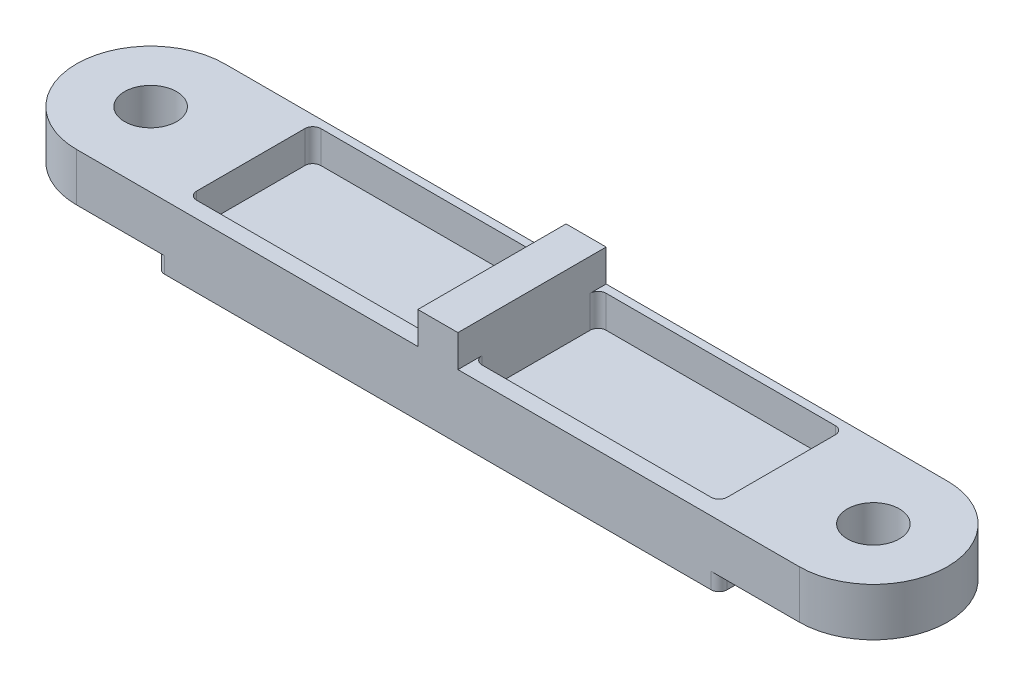
from build123d import *

# Parameters (mm, degrees)
SKETCH1_W           = 35.1
SKETCH1_H           = 18.5
BOSS_EXTRUDE1_DEPTH = 8
SKETCH10_R          = 3.25
BOLT_EXTRUDE_DEPTH  = 6
SKETCH7_W           = 33.1
SKETCH7_H           = 15.5
CUT_EXTRUDE5_DEPTH  = 4
SKETCH8_W           = 5
SKETCH8_H           = 18.5
BOSS_EXTRUDE3_DEPTH = 8
FILLET6_R           = 1


with BuildPart() as part:
    # Sketch1 → Boss-Extrude1 (new body)
    with BuildSketch(Plane(origin=(0, 0, 0), x_dir=(1, 0, 0), z_dir=(0, 1, 0))):
        with Locations((-17.55, 0)):
            Rectangle(SKETCH1_W, SKETCH1_H)
    extrude(amount=BOSS_EXTRUDE1_DEPTH)

    # Sketch10 → bolt extrude (add)
    with BuildSketch(Plane(origin=(0, 8, 0), x_dir=(1, 0, 0), z_dir=(0, 1, 0))):
        with BuildLine():
            Line((-35.1, 9.25), (-45.1, 9.25))
            ThreePointArc((-45.1, 9.25), (-54.35, 0), (-45.1, -9.25))
            Line((-45.1, -9.25), (-35.1, -9.25))
            Line((-35.1, -9.25), (-35.1, 9.25))
        make_face()
        with Locations(Location((-45.1, 0, 0), (0, 0, 270))):
            Circle(SKETCH10_R, mode=Mode.SUBTRACT)
    extrude(amount=-BOLT_EXTRUDE_DEPTH)

    # Sketch7 → Cut-Extrude5 (cut)
    with BuildSketch(Plane(origin=(0, 8, 0), x_dir=(1, 0, 0), z_dir=(0, 1, 0))):
        with Locations((-16.55, 0.5)):
            Rectangle(SKETCH7_W, SKETCH7_H)
    extrude(amount=-CUT_EXTRUDE5_DEPTH, mode=Mode.SUBTRACT)

    # Mirror1: part across plane


with BuildPart() as part_1:
    add(part.part)
    add(part.part.mirror(Plane(origin=(0, 0, 0), x_dir=(0, 0, 1), z_dir=(1, 0, 0))))

    # Sketch8 → Boss-Extrude3 (add)
    with BuildSketch(Plane(origin=(0, 4, 0), x_dir=(1, 0, 0), z_dir=(0, 1, 0))):
        Rectangle(SKETCH8_W, SKETCH8_H)
    extrude(amount=BOSS_EXTRUDE3_DEPTH)

    # Fillet6
    fillet6_edges = [part_1.edges().sort_by_distance(p)[0] for p in [
        (-35.1, 1, 9.25),
        (-35.1, 1, -9.25),
        (-33.1, 6, -8.25),
        (-33.1, 6, 7.25),
        (35.1, 1, -9.25),
        (35.1, 1, 9.25),
        (33.1, 6, -8.25),
        (33.1, 6, 7.25),
        (-2.5, 6, 7.25),
        (2.5, 6, 7.25),
        (2.5, 6, -8.25),
        (-2.5, 6, -8.25),
    ]]
    fillet(fillet6_edges, radius=FILLET6_R)


solid = part_1.part
